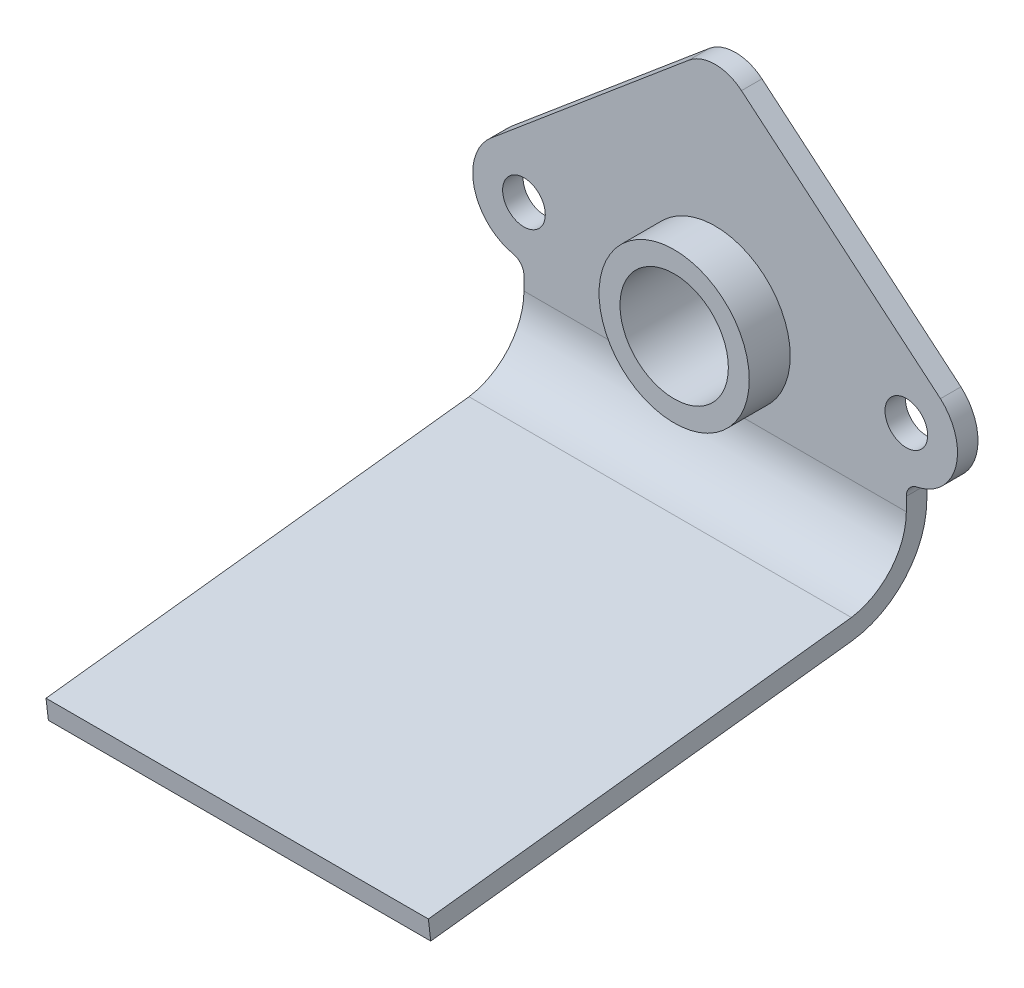
from build123d import *
from build123d.topology import SkipClean

# Parameters (mm, degrees)
SKETCH2_R           = 3.125
SKETCH2_R_2         = 7.9375
BOSS_EXTRUDE2_DEPTH = 3
BOSS_EXTRUDE3_START = 6
SKETCH5_R           = 11
SKETCH5_R_2         = 7.9375
BOSS_EXTRUDE3_DEPTH = 6
SKETCH6_R           = 11
SKETCH6_R_2         = 7.9375
BOSS_EXTRUDE4_DEPTH = 6
BOSS_EXTRUDE5_DEPTH = 56
FILLET1_R           = 2


with BuildPart() as part:
    # Sketch2 → Boss-Extrude2 (new body)
    # profile 1 of 2: a face of its own
    with BuildSketch(Plane.XY):
        with BuildLine():
            ThreePointArc((3.861106297, 30.092587306), (0, 31.5), (-3.861106297, 30.092587306))
            Line((-3.861106297, 30.092587306), (-32.826382871, 5.740734133))
            ThreePointArc((-32.826382871, 5.740734133), (-35.046470961, -2.568510658), (-28, -7.5))
            Line((-28, -7.5), (-28, -11.25))
            Line((-28, -11.25), (28, -11.25))
            Line((28, -11.25), (28, -7.5))
            ThreePointArc((28, -7.5), (35.006811058, -2.674808179), (32.997833475, 5.592106988))
            Line((32.997833475, 5.592106988), (32.651575677, 5.883268116))
            Line((32.651575677, 5.883268116), (3.86193439, 30.091890979))
            Line((3.86193439, 30.091890979), (3.861106297, 30.092587306))
        make_face()
        with Locations((-28, 0)):
            Circle(SKETCH2_R, mode=Mode.SUBTRACT)
        with BuildLine():
            ThreePointArc((0, -11), (-0.700886243, -10.97764813), (-1.3989241, -10.910683359))
            ThreePointArc((-1.3989241, -10.910683359), (-7.266768019, 8.25797085), (11, 0))
            ThreePointArc((11, 0), (7.778174593, -7.778174593), (0, -11))
        make_face(mode=Mode.SUBTRACT)
        with Locations((28, 0)):
            Circle(SKETCH2_R, mode=Mode.SUBTRACT)
    # profile 2 of 2: a face of its own
    with BuildSketch(Plane.XY):
        with BuildLine():
            ThreePointArc((11, 0), (-7.266768019, 8.25797085), (-1.3989241, -10.910683359))
            ThreePointArc((-1.3989241, -10.910683359), (-0.700886243, -10.97764813), (0, -11))
            ThreePointArc((0, -11), (7.778174593, -7.778174593), (11, 0))
        make_face()
        Circle(SKETCH2_R_2, mode=Mode.SUBTRACT)
    extrude(amount=BOSS_EXTRUDE2_DEPTH)

    # Sketch5 → Boss-Extrude3 (add)
    with SkipClean():  # the faces are left unmerged after this step: merging them gives an invalid solid
        with BuildSketch(Plane(origin=(0, 0, 0), x_dir=(-1, 0, 0), z_dir=(0, 0, -1)).offset(BOSS_EXTRUDE3_START)):
            with Locations(Location((0, 0, 0), (0, 0, 180))):
                Circle(SKETCH5_R)
            Circle(SKETCH5_R_2, mode=Mode.SUBTRACT)
        extrude(amount=-BOSS_EXTRUDE3_DEPTH)

    # Sketch6 → Boss-Extrude4 (add)
    with BuildSketch(Plane.XY.offset(3)):
        Circle(SKETCH6_R)
        with Locations(Location((0, 0, 0), (0, 0, 180))):
            Circle(SKETCH6_R_2, mode=Mode.SUBTRACT)
    extrude(amount=BOSS_EXTRUDE4_DEPTH)

    # Sketch8 → Boss-Extrude5 (add)
    with BuildSketch(Plane.ZY.offset(28)):
        with BuildLine():
            Line((73, -27.9), (19.471115904, -21.625622538))
            Line((19.471115904, -21.625622538), (11.046076805, -20.638083262))
            ThreePointArc((11.046076805, -20.638083262), (5.286738936, -17.432140796), (3, -11.25))
            Line((3, -11.25), (0, -11.25))
            ThreePointArc((0, -11.25), (3.161262399, -19.558909677), (11.046076805, -23.665156356))
            Line((11.046076805, -23.665156356), (72.651058433, -30.879637525))
            Line((72.651058433, -30.879637525), (73, -27.9))
        make_face()
    extrude(amount=-BOSS_EXTRUDE5_DEPTH)

    # Fillet1
    fillet1_edges = [part.edges().sort_by_distance(p)[0] for p in [
        (-28, -7.5, 1.5),
        (28, -7.5, 1.5),
    ]]
    fillet(fillet1_edges, radius=FILLET1_R)


solid = part.part
